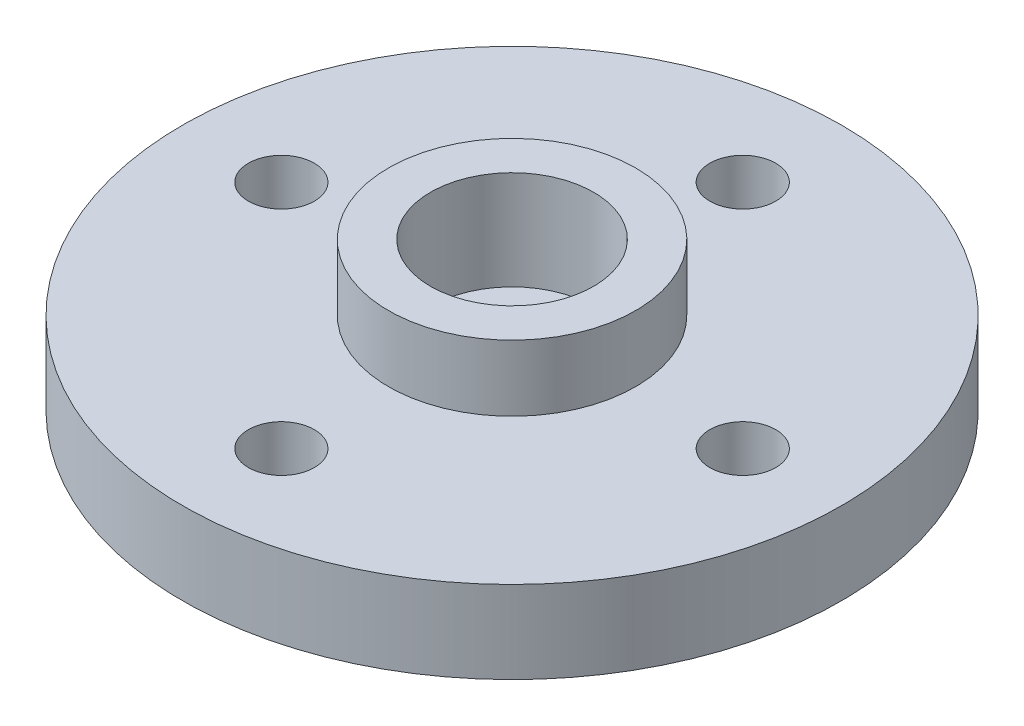
from build123d import *

# Parameters (mm, degrees)
SKETCH_2_R          = 1.2
CUT_EXTRUDE_1_DEPTH = 10
SKETCH_3_R          = 2.475
CUT_EXTRUDE_2_DEPTH = 3
SKETCH_4_R          = 1
CUT_EXTRUDE_3_DEPTH = 3


with BuildPart() as part:
    # 草图1 → 旋转1 (revolve)
    with BuildSketch(Plane.XY, mode=Mode.PRIVATE) as revolve_1_sk:
        Polygon((0, 0), (10, 0), (10, 2.5), (3.75, 2.5), (3.75, 4.5), (0, 4.5), align=None)
    revolve(revolve_1_sk.sketch.rotate(Axis((0, 0, 0), (0, 1, 0)), 90), axis=Axis((0, 0, 0), (0, 1, 0)))

    # 草图2 → 切除-拉伸1 (cut)
    with BuildSketch(Plane(origin=(0, 4.5, 0), x_dir=(1, 0, 0), z_dir=(0, 1, 0))):
        with Locations(Location((0, 0, 0), (0, 0, 270))):
            Circle(SKETCH_2_R)
    extrude(amount=-CUT_EXTRUDE_1_DEPTH, mode=Mode.SUBTRACT)

    # 草图3 → 切除-拉伸2 (cut)
    with BuildSketch(Plane(origin=(0, 4.5, 0), x_dir=(1, 0, 0), z_dir=(0, 1, 0))):
        with Locations(Location((0, 0, 0), (0, 0, 270))):
            Circle(SKETCH_3_R)
    extrude(amount=-CUT_EXTRUDE_2_DEPTH, mode=Mode.SUBTRACT)

    # 草图4 → 切除-拉伸3 (cut)
    with BuildSketch(Plane.XZ):
        with Locations(Location((7, 0, 0), (0, 0, 270))):
            Circle(SKETCH_4_R)
        with Locations(Location((0, -7, 0), (0, 0, 270))):
            Circle(SKETCH_4_R)
        with Locations(Location((-7, 0, 0), (0, 0, 270))):
            Circle(SKETCH_4_R)
        with Locations(Location((0, 7, 0), (0, 0, 270))):
            Circle(SKETCH_4_R)
    extrude(amount=-CUT_EXTRUDE_3_DEPTH, mode=Mode.SUBTRACT)


solid = part.part
